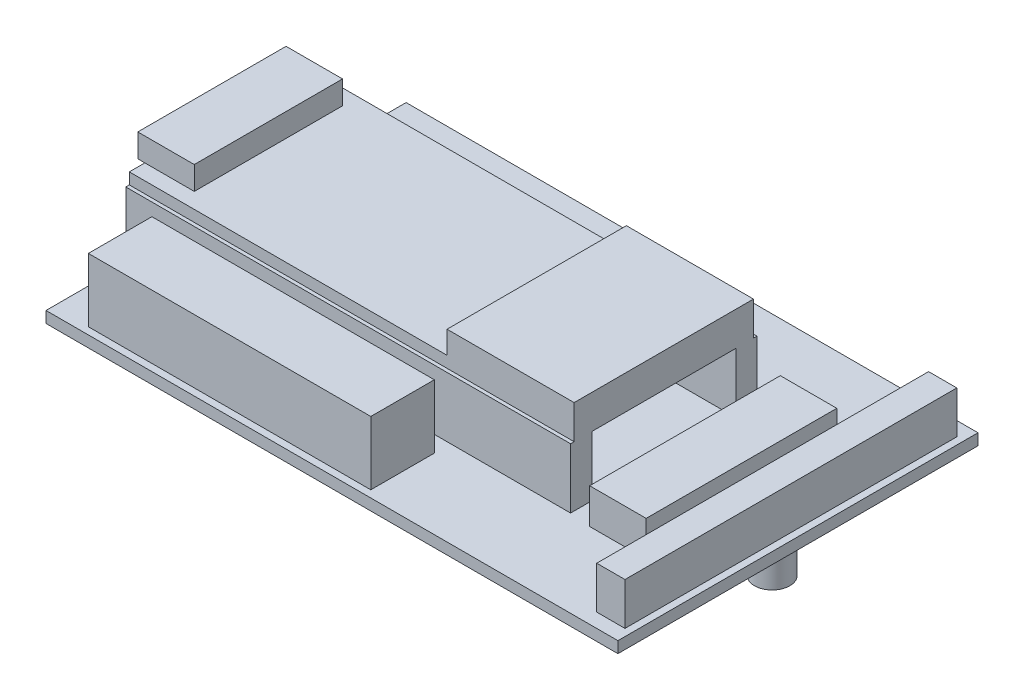
from build123d import *

# Parameters (mm, degrees)
SK_P01_STANDOFF_R                  = 2.5
P01_STANDOFF_DEPTH                 = 5
SK_P02_STANDOFF_R                  = 2.5
P02_STANDOFF_DEPTH                 = 5
P03_PERMAPROTOHALFSIZECARRIE_START = 5
SK_P03_PERMAPROTOHALFSIZECARRIE_W  = 81
SK_P03_PERMAPROTOHALFSIZECARRIE_H  = 51
P03_PERMAPROTOHALFSIZECARRIE_DEPTH = 1.6
P04_SOCKETROW_START                = 6.6
SK_P04_SOCKETROW_W                 = 63
SK_P04_SOCKETROW_H                 = 3
P04_SOCKETROW_DEPTH                = 8.5
P05_SOCKETROW_START                = 6.6
SK_P05_SOCKETROW_W                 = 63
SK_P05_SOCKETROW_H                 = 3
P05_SOCKETROW_DEPTH                = 8.5
P06_DEVKITC1_START                 = 15.1
SK_P06_DEVKITC1_W                  = 63
SK_P06_DEVKITC1_H                  = 25.4
P06_DEVKITC1_DEPTH                 = 1.6
P07_WROOM2MODULE_START             = 16.7
SK_P07_WROOM2MODULE_W              = 18
SK_P07_WROOM2MODULE_H              = 25.4
P07_WROOM2MODULE_DEPTH             = 3.2
P08_USBCX2_START                   = 16.7
SK_P08_USBCX2_W                    = 8
SK_P08_USBCX2_H                    = 21
P08_USBCX2_DEPTH                   = 3.3
P09_74LVC244_START                 = 6.6
SK_P09_74LVC244_W                  = 8
SK_P09_74LVC244_H                  = 27
P09_74LVC244_DEPTH                 = 5
P10_JSTXHHEADERSVERTICAL_START     = 6.6
SK_P10_JSTXHHEADERSVERTICAL_W      = 4
SK_P10_JSTXHHEADERSVERTICAL_H      = 47
P10_JSTXHHEADERSVERTICAL_DEPTH     = 6
P11_2X12BOXHEADERDECKSIGNALS_START = 6.6
SK_P11_2X12BOXHEADERDECKSIGNALS_W  = 40
SK_P11_2X12BOXHEADERDECKSIGNALS_H  = 9
P11_2X12BOXHEADERDECKSIGNALS_DEPTH = 9


with BuildPart() as part:
    # SK_P01_Standoff → P01_Standoff (new body)
    with BuildSketch(Plane(origin=(0, 0, 0), x_dir=(1, 0, 0), z_dir=(0, 1, 0))):
        with Locations(Location((-35.85, 0, 0), (0, 0, 270))):
            Circle(SK_P01_STANDOFF_R)
    extrude(amount=P01_STANDOFF_DEPTH)



with BuildPart() as body_2:
    # SK_P02_Standoff → P02_Standoff (new body)
    with BuildSketch(Plane(origin=(0, 0, 0), x_dir=(1, 0, 0), z_dir=(0, 1, 0))):
        with Locations(Location((37.85, 0, 0), (0, 0, 270))):
            Circle(SK_P02_STANDOFF_R)
    extrude(amount=P02_STANDOFF_DEPTH)


with BuildPart() as part_1:
    add(part.part)

    add(body_2.part)  # P03_PermaProtohalfsizecarrie merges body 2
    # SK_P03_PermaProtohalfsizecarrie → P03_PermaProtohalfsizecarrie (add)
    with BuildSketch(Plane(origin=(0, 0, 0), x_dir=(1, 0, 0), z_dir=(0, 1, 0)).offset(P03_PERMAPROTOHALFSIZECARRIE_START)):
        with Locations((1, 0)):
            Rectangle(SK_P03_PERMAPROTOHALFSIZECARRIE_W, SK_P03_PERMAPROTOHALFSIZECARRIE_H)
    extrude(amount=P03_PERMAPROTOHALFSIZECARRIE_DEPTH)

    # SK_P04_Socketrow → P04_Socketrow (add)
    with BuildSketch(Plane(origin=(0, 0, 0), x_dir=(1, 0, 0), z_dir=(0, 1, 0)).offset(P04_SOCKETROW_START)):
        with Locations((-9, 11.7)):
            Rectangle(SK_P04_SOCKETROW_W, SK_P04_SOCKETROW_H)
    extrude(amount=P04_SOCKETROW_DEPTH)

    # SK_P05_Socketrow → P05_Socketrow (add)
    with BuildSketch(Plane(origin=(0, 0, 0), x_dir=(1, 0, 0), z_dir=(0, 1, 0)).offset(P05_SOCKETROW_START)):
        with Locations((-9, -11.7)):
            Rectangle(SK_P05_SOCKETROW_W, SK_P05_SOCKETROW_H)
    extrude(amount=P05_SOCKETROW_DEPTH)

    # SK_P06_DevKitC1 → P06_DevKitC1 (add)
    with BuildSketch(Plane(origin=(0, 0, 0), x_dir=(1, 0, 0), z_dir=(0, 1, 0)).offset(P06_DEVKITC1_START)):
        with Locations((-9, 0)):
            Rectangle(SK_P06_DEVKITC1_W, SK_P06_DEVKITC1_H)
    extrude(amount=P06_DEVKITC1_DEPTH)

    # SK_P07_WROOM2module → P07_WROOM2module (add)
    with BuildSketch(Plane(origin=(0, 0, 0), x_dir=(1, 0, 0), z_dir=(0, 1, 0)).offset(P07_WROOM2MODULE_START)):
        with Locations((13.5, 0)):
            Rectangle(SK_P07_WROOM2MODULE_W, SK_P07_WROOM2MODULE_H)
    extrude(amount=P07_WROOM2MODULE_DEPTH)

    # SK_P08_USBCx2 → P08_USBCx2 (add)
    with BuildSketch(Plane(origin=(0, 0, 0), x_dir=(1, 0, 0), z_dir=(0, 1, 0)).offset(P08_USBCX2_START)):
        with Locations((-37.5, 0)):
            Rectangle(SK_P08_USBCX2_W, SK_P08_USBCX2_H)
    extrude(amount=P08_USBCX2_DEPTH)

    # SK_P09_74LVC244 → P09_74LVC244 (add)
    with BuildSketch(Plane(origin=(0, 0, 0), x_dir=(1, 0, 0), z_dir=(0, 1, 0)).offset(P09_74LVC244_START)):
        with Locations((29.5, 0)):
            Rectangle(SK_P09_74LVC244_W, SK_P09_74LVC244_H)
    extrude(amount=P09_74LVC244_DEPTH)

    # SK_P10_JSTXHheadersvertical → P10_JSTXHheadersvertical (add)
    with BuildSketch(Plane(origin=(0, 0, 0), x_dir=(1, 0, 0), z_dir=(0, 1, 0)).offset(P10_JSTXHHEADERSVERTICAL_START)):
        with Locations((38.5, 0)):
            Rectangle(SK_P10_JSTXHHEADERSVERTICAL_W, SK_P10_JSTXHHEADERSVERTICAL_H)
    extrude(amount=P10_JSTXHHEADERSVERTICAL_DEPTH)

    # SK_P11_2x12boxheaderdecksignals → P11_2x12boxheaderdecksignals (add)
    with BuildSketch(Plane(origin=(0, 0, 0), x_dir=(1, 0, 0), z_dir=(0, 1, 0)).offset(P11_2X12BOXHEADERDECKSIGNALS_START)):
        with Locations((-14.5, -20)):
            Rectangle(SK_P11_2X12BOXHEADERDECKSIGNALS_W, SK_P11_2X12BOXHEADERDECKSIGNALS_H)
    extrude(amount=P11_2X12BOXHEADERDECKSIGNALS_DEPTH)


solid = part_1.part
